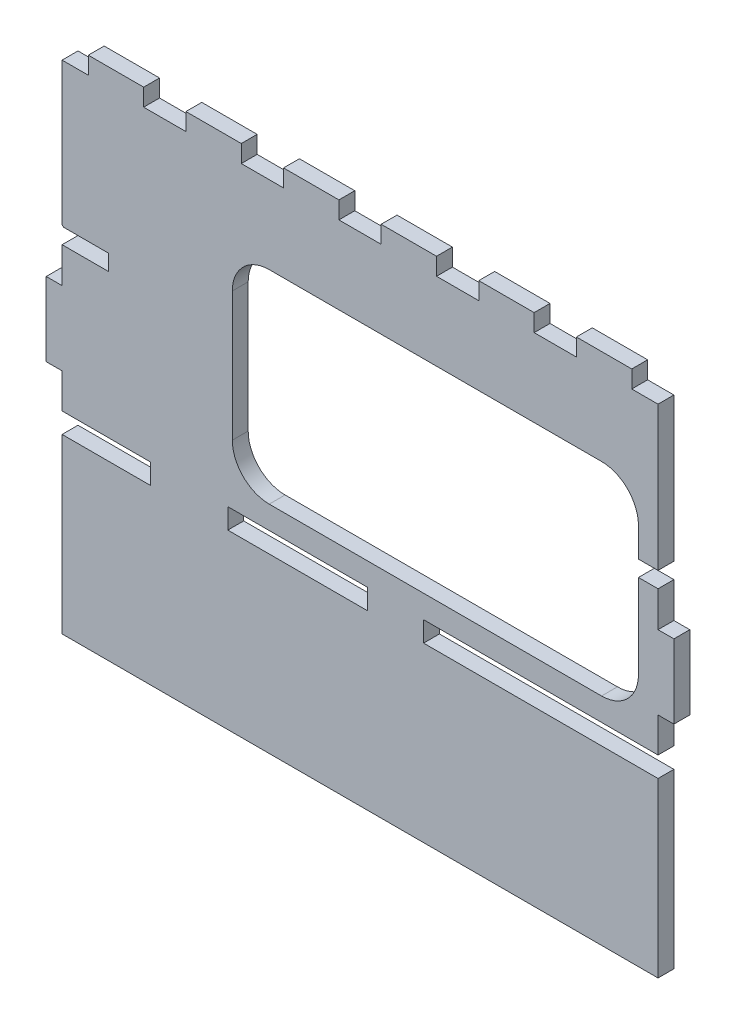
from build123d import *

# Parameters (mm, degrees)
SKETCH2_W           = 37.77
SKETCH2_H           = 5.5
BOSS_EXTRUDE1_DEPTH = 4.3


with BuildPart() as part:
    # Sketch2 → Boss-Extrude1 (new body)
    with BuildSketch(Plane.XY):
        with BuildLine():
            Line((-58.61, 69.65), (-73.61, 69.65))
            Line((-73.61, 69.65), (-73.61, 64.95))
            Line((-73.61, 64.95), (-80.7, 64.95))
            Line((-80.7, 64.95), (-80.7, 26.35))
            Line((-80.7, 26.35), (-80.318, 25.95))
            Line((-80.318, 25.95), (-68.2, 25.95))
            Line((-68.2, 25.95), (-68.2, 21.65))
            Line((-68.2, 21.65), (-80.7, 21.65))
            Line((-80.7, 21.65), (-80.7, 12.05))
            Line((-80.7, 12.05), (-85, 12.05))
            Line((-85, 12.05), (-85, -7.95))
            Line((-85, -7.95), (-80.7, -7.95))
            Line((-80.7, -7.95), (-80.7, -17.35))
            Line((-80.7, -17.35), (-56.729583067, -17.35))
            Line((-56.729583067, -17.35), (-56.729583067, -22.85))
            Line((-56.729583067, -22.85), (-80.7, -22.85))
            Line((-80.7, -22.85), (-80.7, -69.65))
            Line((-80.7, -69.65), (80.7, -69.65))
            Line((80.7, -69.65), (80.7, -22.85))
            Line((80.7, -22.85), (17.2, -22.85))
            Line((17.2, -22.85), (17.2, -17.35))
            Line((17.2, -17.35), (80.7, -17.35))
            Line((80.7, -17.35), (80.7, -7.95))
            Line((80.7, -7.95), (85, -7.95))
            Line((85, -7.95), (85, 12.05))
            Line((85, 12.05), (80.7, 12.05))
            Line((80.7, 12.05), (80.7, 21.65))
            Line((80.7, 21.65), (80.282, 21.65))
            Line((80.282, 21.65), (75.4, 21.65))
            Line((75.4, 21.65), (75.4, -1.15))
            ThreePointArc((75.4, -1.15), (72.471067812, -8.221067812), (65.4, -11.15))
            Line((65.4, -11.15), (-24.6, -11.15))
            ThreePointArc((-24.6, -11.15), (-31.671067812, -8.221067812), (-34.6, -1.15))
            Line((-34.6, -1.15), (-34.6, 33.85))
            ThreePointArc((-34.6, 33.85), (-31.671067812, 40.921067812), (-24.6, 43.85))
            Line((-24.6, 43.85), (65.4, 43.85))
            ThreePointArc((65.4, 43.85), (72.471067812, 40.921067812), (75.4, 33.85))
            Line((75.4, 33.85), (75.4, 25.95))
            Line((75.4, 25.95), (79.9, 25.95))
            Line((79.9, 25.95), (80.7, 25.95))
            Line((80.7, 25.95), (80.7, 64.95))
            Line((80.7, 64.95), (73.59, 64.95))
            Line((73.59, 64.95), (73.59, 69.65))
            Line((73.59, 69.65), (58.59, 69.65))
            Line((58.59, 69.65), (58.59, 64.95))
            Line((58.59, 64.95), (47.15, 64.95))
            Line((47.15, 64.95), (47.15, 69.65))
            Line((47.15, 69.65), (32.15, 69.65))
            Line((32.15, 69.65), (32.15, 64.95))
            Line((32.15, 64.95), (20.71, 64.95))
            Line((20.71, 64.95), (20.71, 69.65))
            Line((20.71, 69.65), (5.71, 69.65))
            Line((5.71, 69.65), (5.71, 64.95))
            Line((5.71, 64.95), (-5.73, 64.95))
            Line((-5.73, 64.95), (-5.73, 69.65))
            Line((-5.73, 69.65), (-20.73, 69.65))
            Line((-20.73, 69.65), (-20.73, 64.95))
            Line((-20.73, 64.95), (-32.17, 64.95))
            Line((-32.17, 64.95), (-32.17, 69.65))
            Line((-32.17, 69.65), (-47.17, 69.65))
            Line((-47.17, 69.65), (-47.17, 64.95))
            Line((-47.17, 64.95), (-58.61, 64.95))
            Line((-58.61, 64.95), (-58.61, 69.65))
        make_face()
        with Locations((-16.933, -20.1)):
            Rectangle(SKETCH2_W, SKETCH2_H, mode=Mode.SUBTRACT)
    extrude(amount=BOSS_EXTRUDE1_DEPTH)


solid = part.part
